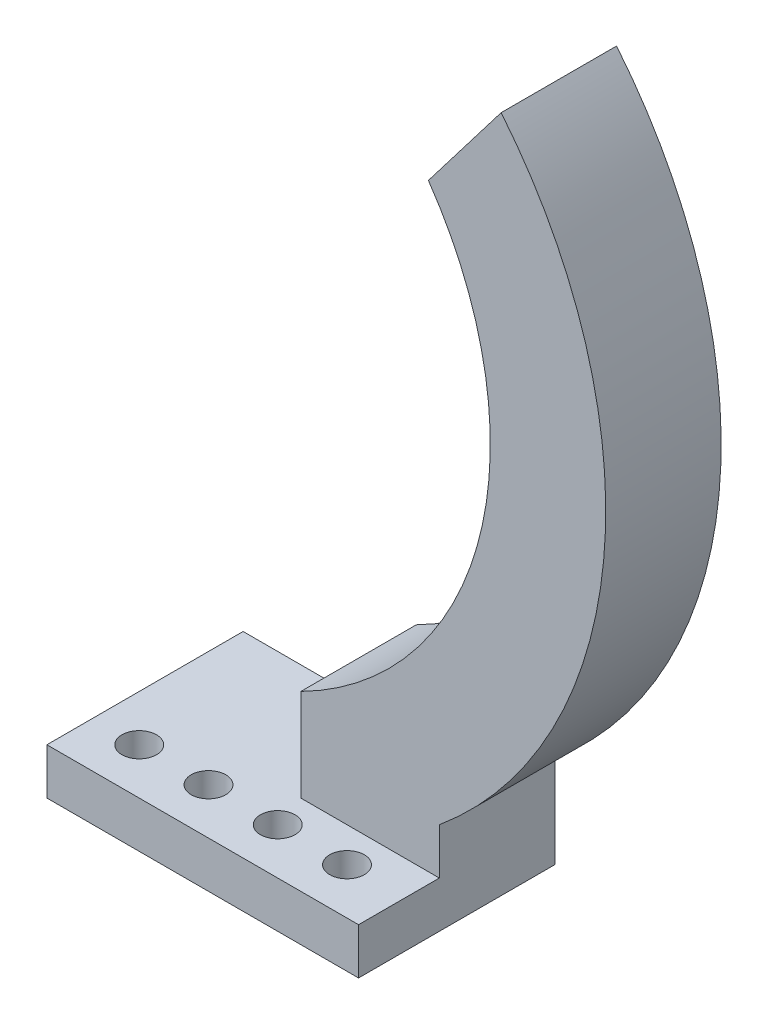
from build123d import *

# Parameters (mm, degrees)
BOSS_EXTRUDE1_DEPTH     = 10
SKETCH3_W               = 27
SKETCH3_H               = 4
BOSS_EXTRUDE2_DEPTH     = 17
SKETCH4_R               = 1.5
CUT_EXTRUDE1_DEPTH      = 4
CUT_EXTRUDE2_DEPTH      = 15
CUT_EXTRUDE2_DEPTH_BACK = 27
SKETCH5_W               = 24.801401456
SKETCH5_H               = 70.149949376


with BuildPart() as part:
    # Sketch1 → Boss-Extrude1 (new body)
    with BuildSketch(Plane.XY):
        with BuildLine():
            Line((0.947795447, 55.867567374), (-5.354013975, 64.102890964))
            ThreePointArc((-5.354013975, 64.102890964), (-14.235235054, 34.948420067), (0, 8))
            Line((0, 8), (0, 4))
            Line((0, 4), (0, 0))
            Line((0, 0), (27, 0))
            Line((27, 0), (27, 4))
            Line((27, 4), (12, 4))
            Line((12, 4), (12, 12))
            ThreePointArc((12, 12), (-3.507060252, 31.419133439), (0.947795447, 55.867567374))
        make_face()
    boss_extrude1 = extrude(amount=BOSS_EXTRUDE1_DEPTH)

    # Sketch3 → Boss-Extrude2 (add)
    with BuildSketch(Plane.XY):
        with Locations((13.5, 2)):
            Rectangle(SKETCH3_W, SKETCH3_H)
    boss_extrude2 = extrude(amount=BOSS_EXTRUDE2_DEPTH)

    # Sketch4 → Cut-Extrude1 (cut)
    with BuildSketch(Plane(origin=(0, 4, 0), x_dir=(1, 0, 0), z_dir=(0, 1, 0))):
        with Locations(Location((5, -13, 0), (0, 0, 270))):
            Circle(SKETCH4_R)
        with Locations(Location((11, -13, 0), (0, 0, 270))):
            Circle(SKETCH4_R)
        with Locations(Location((17, -13, 0), (0, 0, 270))):
            Circle(SKETCH4_R)
        with Locations(Location((23, -13, 0), (0, 0, 270))):
            Circle(SKETCH4_R)
    cut_extrude1 = extrude(amount=-CUT_EXTRUDE1_DEPTH, mode=Mode.SUBTRACT)

    # Mirror8: Boss-Extrude1, Boss-Extrude2, Cut-Extrude1 across plane
    add(boss_extrude1.mirror(Plane(origin=(27, 0, 10), x_dir=(0, 0, 1), z_dir=(-1, 0, 0))))
    add(boss_extrude2.mirror(Plane(origin=(27, 0, 10), x_dir=(0, 0, 1), z_dir=(-1, 0, 0))))
    add(cut_extrude1.mirror(Plane(origin=(27, 0, 10), x_dir=(0, 0, 1), z_dir=(-1, 0, 0))), mode=Mode.SUBTRACT)

    # Sketch5 → Cut-Extrude2 (cut, two sides: drawn at the far end of the back side and taken through both)
    with BuildSketch(Plane.ZY.offset(-CUT_EXTRUDE2_DEPTH_BACK)):
        with Locations((8.5, 31.779897291)):
            Rectangle(SKETCH5_W, SKETCH5_H)
    extrude(amount=CUT_EXTRUDE2_DEPTH + CUT_EXTRUDE2_DEPTH_BACK, mode=Mode.SUBTRACT)


solid = part.part
